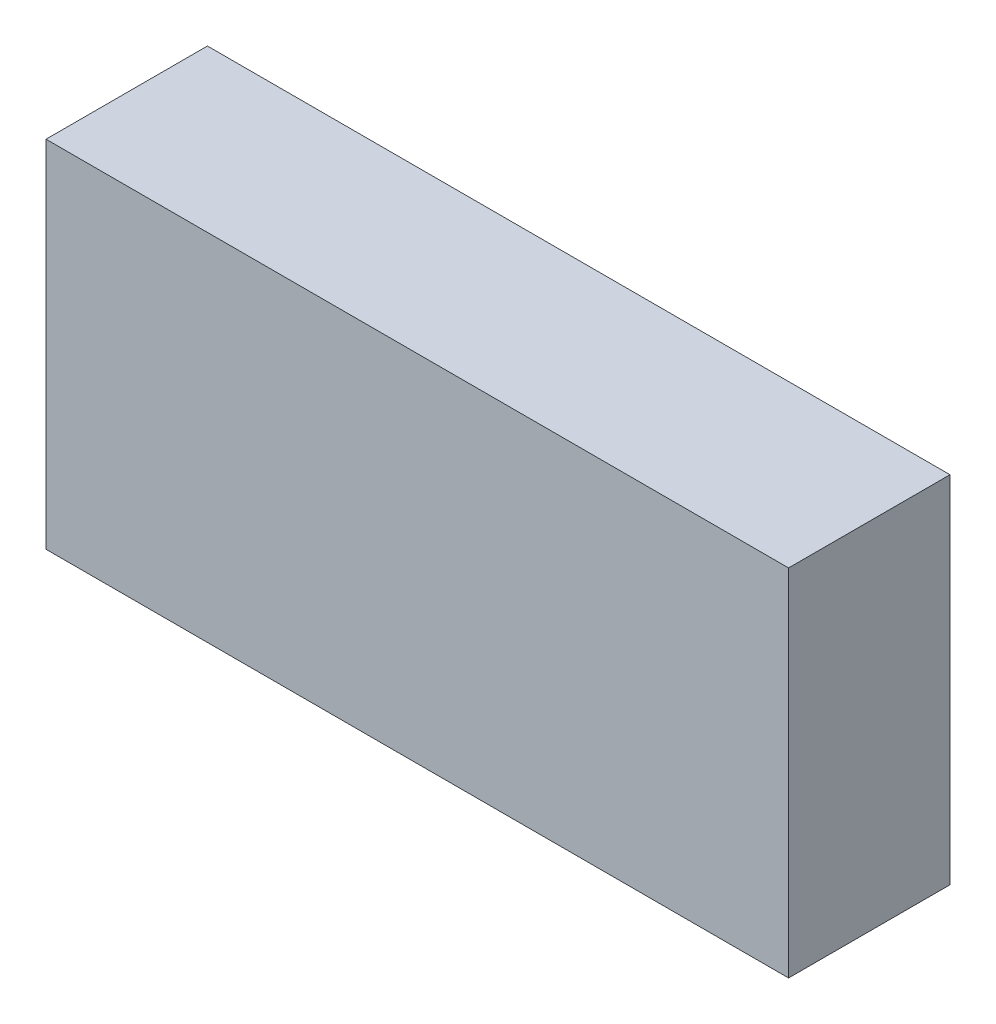
from build123d import *

# Parameters (mm, degrees)
SKETCH1_W           = 230
SKETCH1_H           = 50
BOSS_EXTRUDE1_DEPTH = 110


with BuildPart() as part:
    # Sketch1 → Boss-Extrude1 (new body)
    with BuildSketch(Plane(origin=(0, 0, 0), x_dir=(1, 0, 0), z_dir=(0, 1, 0))):
        Rectangle(SKETCH1_W, SKETCH1_H)
    extrude(amount=BOSS_EXTRUDE1_DEPTH)


solid = part.part
